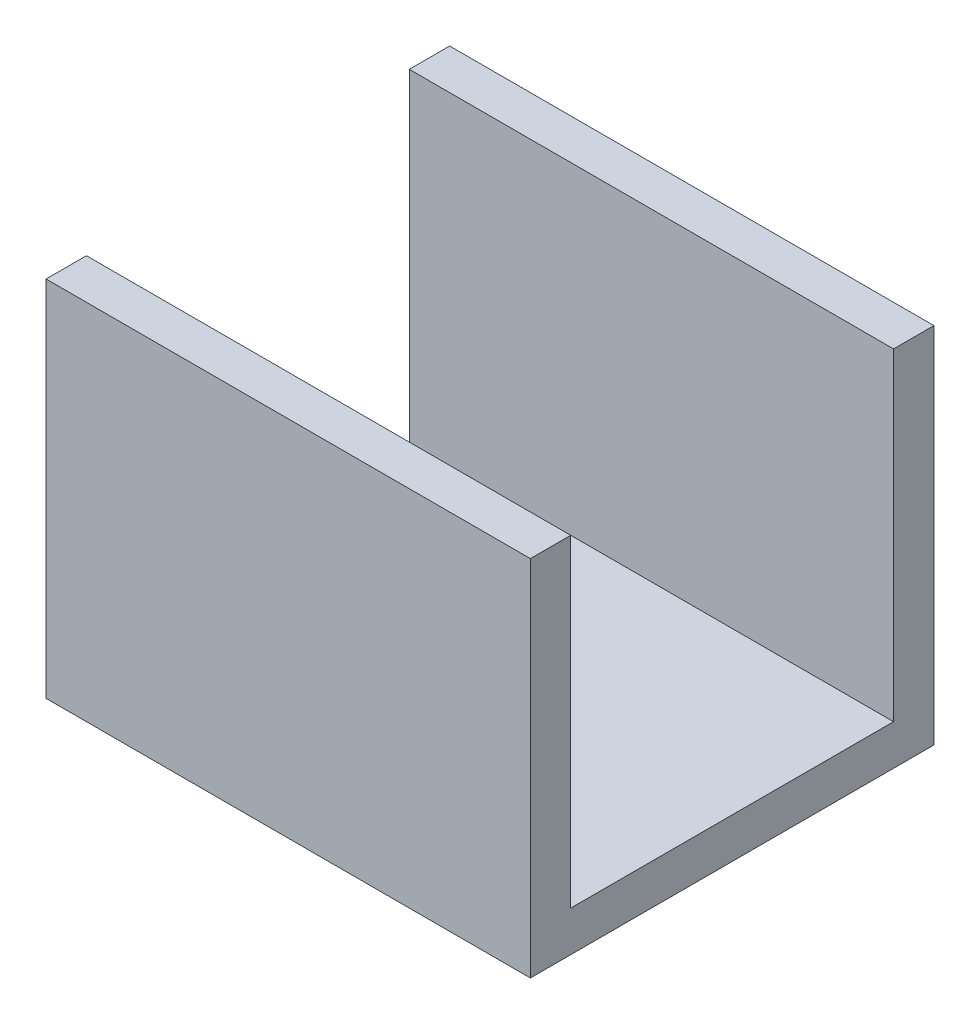
from build123d import *

# Parameters (mm, degrees)
SKETCH1_W           = 76.2
SKETCH1_H           = 63.5
BOSS_EXTRUDE1_DEPTH = 6.35
SKETCH2_W           = 76.2
SKETCH2_H           = 6.35
BOSS_EXTRUDE2_DEPTH = 50.8
SKETCH3_R           = 3.175
BOSS_EXTRUDE3_DEPTH = 25.4


with BuildPart() as part:
    # Sketch1 → Boss-Extrude1 (new body)
    with BuildSketch(Plane(origin=(0, 0, 0), x_dir=(1, 0, 0), z_dir=(0, 1, 0))):
        Rectangle(SKETCH1_W, SKETCH1_H)
    extrude(amount=BOSS_EXTRUDE1_DEPTH)

    # Sketch2 → Boss-Extrude2 (add)
    with BuildSketch(Plane(origin=(0, 6.35, 0), x_dir=(1, 0, 0), z_dir=(0, 1, 0))):
        with Locations((0, 28.575)):
            Rectangle(SKETCH2_W, SKETCH2_H)
        with Locations((0, -28.575)):
            Rectangle(SKETCH2_W, SKETCH2_H)
    extrude(amount=BOSS_EXTRUDE2_DEPTH)

    # Sketch3 → Boss-Extrude3 (add)
    with BuildSketch(Plane.XZ):
        with Locations(Location((0, 0, 0), (0, 0, 270))):
            Circle(SKETCH3_R)
    extrude(amount=BOSS_EXTRUDE3_DEPTH)


solid = part.part
